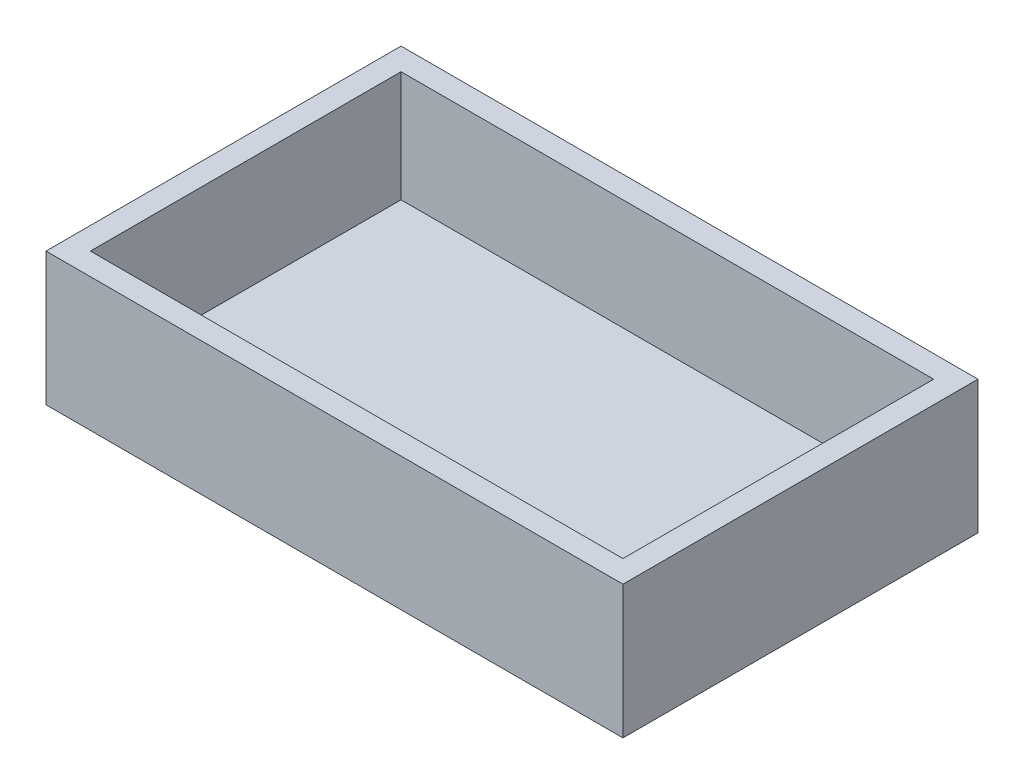
from build123d import *

# Parameters (mm, degrees)
SKETCH1_W           = 130
SKETCH1_H           = 80
BOSS_EXTRUDE1_DEPTH = 5
SKETCH2_W           = 130
SKETCH2_H           = 80
SKETCH2_W_2         = 120
SKETCH2_H_2         = 70
BOSS_EXTRUDE2_DEPTH = 25


with BuildPart() as part:
    # Sketch1 → Boss-Extrude1 (new body)
    with BuildSketch(Plane(origin=(0, 0, 0), x_dir=(1, 0, 0), z_dir=(0, 1, 0))):
        Rectangle(SKETCH1_W, SKETCH1_H)
    extrude(amount=BOSS_EXTRUDE1_DEPTH)

    # Sketch2 → Boss-Extrude2 (add)
    with BuildSketch(Plane(origin=(0, 5, 0), x_dir=(1, 0, 0), z_dir=(0, 1, 0))):
        Rectangle(SKETCH2_W, SKETCH2_H)
        Rectangle(SKETCH2_W_2, SKETCH2_H_2, mode=Mode.SUBTRACT)
    extrude(amount=BOSS_EXTRUDE2_DEPTH)


solid = part.part
